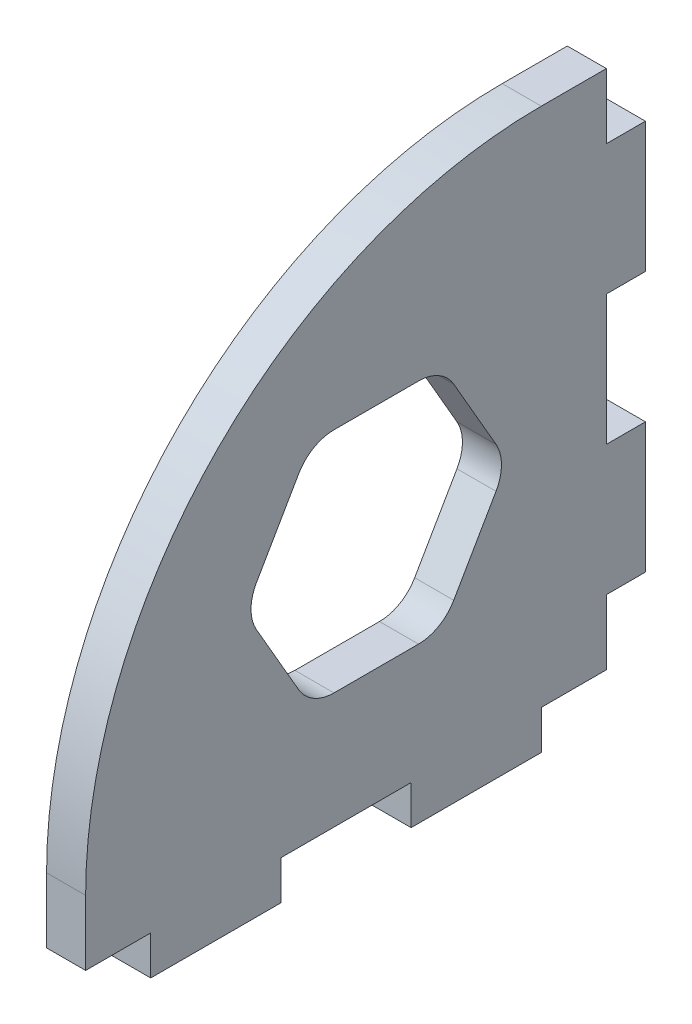
from build123d import *

# Parameters (mm, degrees)
BOSS_EXTRUDE1_DEPTH = 1.5


with BuildPart() as part:
    # Sketch1 → Boss-Extrude1 (new, symmetric)
    with BuildSketch(Plane(origin=(0, 0, 0), x_dir=(0, 0, -1), z_dir=(1, 0, 0))):
        with BuildLine():
            Line((0, 0), (-5, 0))
            Line((-5, 0), (-5, -3))
            Line((-5, -3), (-15, -3))
            Line((-15, -3), (-15, 0))
            Line((-15, 0), (-25, 0))
            Line((-25, 0), (-25, -3))
            Line((-25, -3), (-35, -3))
            Line((-35, -3), (-35, 0))
            Line((-35, 0), (-40, 0))
            Line((-40, 0), (-40, 5))
            ThreePointArc((-40, 5), (-29.748737342, 29.748737342), (-5, 40))
            Line((-5, 40), (0, 40))
            Line((0, 40), (0, 35))
            Line((0, 35), (3, 35))
            Line((3, 35), (3, 25))
            Line((3, 25), (0, 25))
            Line((0, 25), (0, 15))
            Line((0, 15), (3, 15))
            Line((3, 15), (3, 5))
            Line((3, 5), (0, 5))
            Line((0, 5), (0, 0))
        make_face()
        with BuildLine():
            Line((-8.476149614, 19.24016953), (-11.723744879, 24.86516953))
            ThreePointArc((-11.723744879, 24.86516953), (-12.867574265, 26.008998916), (-14.430074265, 26.42766953))
            Line((-14.430074265, 26.42766953), (-20.925264794, 26.42766953))
            ThreePointArc((-20.925264794, 26.42766953), (-22.487764794, 26.008998916), (-23.631594181, 24.86516953))
            Line((-23.631594181, 24.86516953), (-26.879189445, 19.24016953))
            ThreePointArc((-26.879189445, 19.24016953), (-27.297860058, 17.67766953), (-26.879189445, 16.11516953))
            Line((-26.879189445, 16.11516953), (-23.631594181, 10.49016953))
            ThreePointArc((-23.631594181, 10.49016953), (-22.487764794, 9.346340143), (-20.925264794, 8.92766953))
            Line((-20.925264794, 8.92766953), (-14.430074265, 8.92766953))
            ThreePointArc((-14.430074265, 8.92766953), (-12.867574265, 9.346340143), (-11.723744879, 10.49016953))
            Line((-11.723744879, 10.49016953), (-8.476149614, 16.11516953))
            ThreePointArc((-8.476149614, 16.11516953), (-8.057479001, 17.67766953), (-8.476149614, 19.24016953))
        make_face(mode=Mode.SUBTRACT)
    extrude(amount=BOSS_EXTRUDE1_DEPTH, both=True)


solid = part.part
